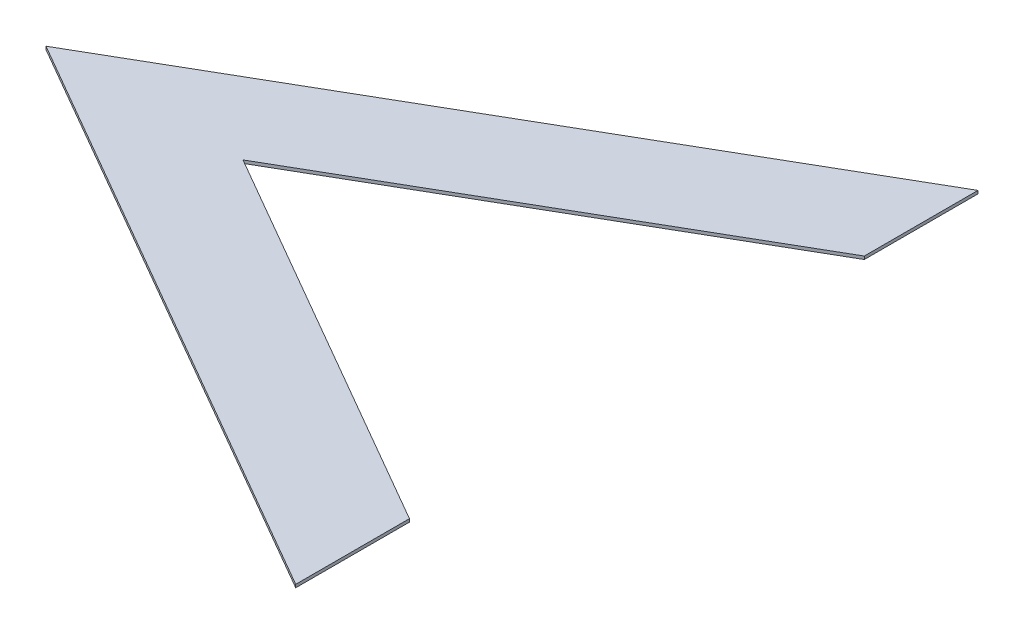
from build123d import *

# Parameters (mm, degrees)
BOSS_EXTRUDE1_DEPTH = 0.25


with BuildPart() as part:
    # Sketch1 → Boss-Extrude1 (new body)
    with BuildSketch(Plane(origin=(0, 71.122875922, 0), x_dir=(1, 0, 0), z_dir=(0, 1, 0))):
        Polygon((34.560206588, -76.268641397), (-13.937216024, -104.268641397), (34.560206588, -132.268641397), (34.560206588, -122.935308064), (2.228591513, -104.268641397), (34.560206588, -85.60197473), align=None)
    extrude(amount=BOSS_EXTRUDE1_DEPTH)


solid = part.part
